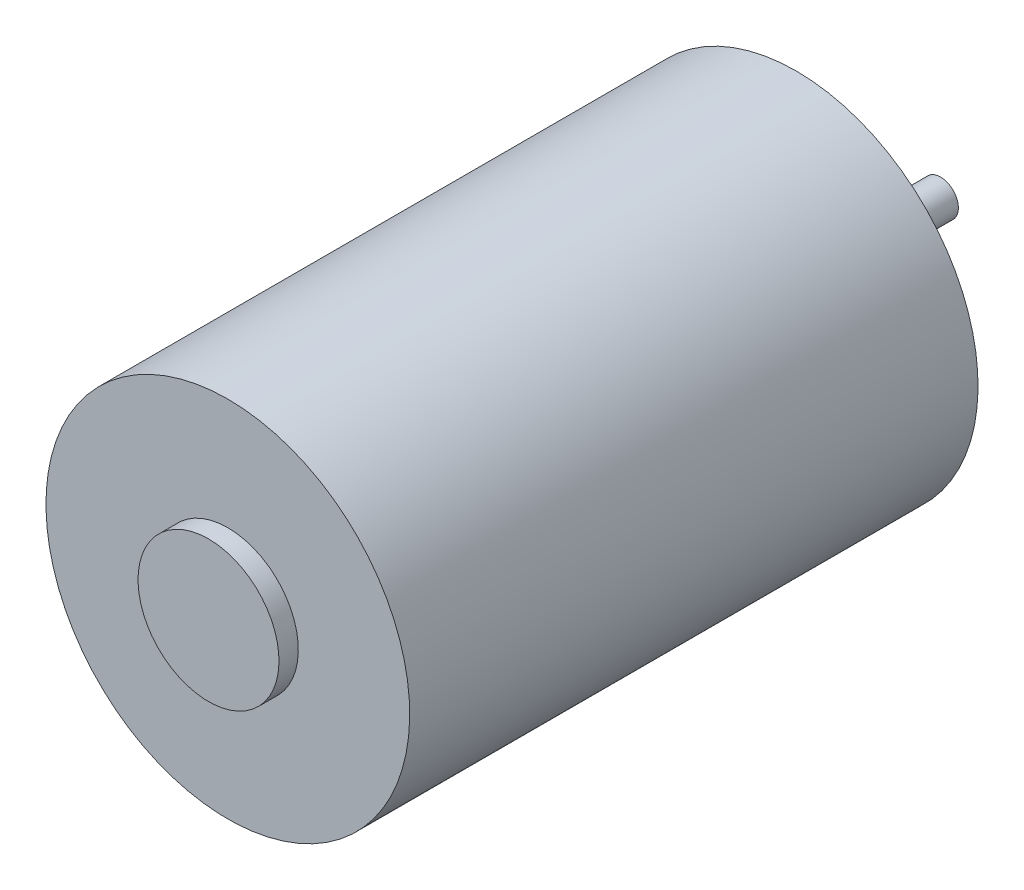
from build123d import *

# Parameters (mm, degrees)
SKETCH3_R      = 2
EXTRUDE1_DEPTH = 10


with BuildPart() as part:
    # Sketch2 → Revolve1 (revolve)
    with BuildSketch(Plane(origin=(0, 0, 0), x_dir=(0, 0, -1), z_dir=(1, 0, 0)), mode=Mode.PRIVATE) as revolve1_sk:
        Polygon((0, 0), (0, -6.2), (1.7, -6.2), (1.7, -16), (51.7, -16), (51.7, -6.2), (53.4, -6.2), (53.4, -1.57), (64.4, -1.57), (64.4, 0), align=None)
    revolve(revolve1_sk.sketch.rotate(Axis((0, 0, -64.4), (0, 0, 1)), 180), axis=Axis((0, 0, -64.4), (0, 0, 1)))

    # Sketch3 → Extrude1 (cut)
    with BuildSketch(Plane(origin=(0, 0, -51.7), x_dir=(-1, 0, 0), z_dir=(0, 0, -1))):
        with Locations(Location((12.7, 0, 0), (0, 0, 90))):
            Circle(SKETCH3_R)
        with Locations(Location((-12.7, 0, 0), (0, 0, 90))):
            Circle(SKETCH3_R)
    extrude(amount=-EXTRUDE1_DEPTH, mode=Mode.SUBTRACT)


solid = part.part
